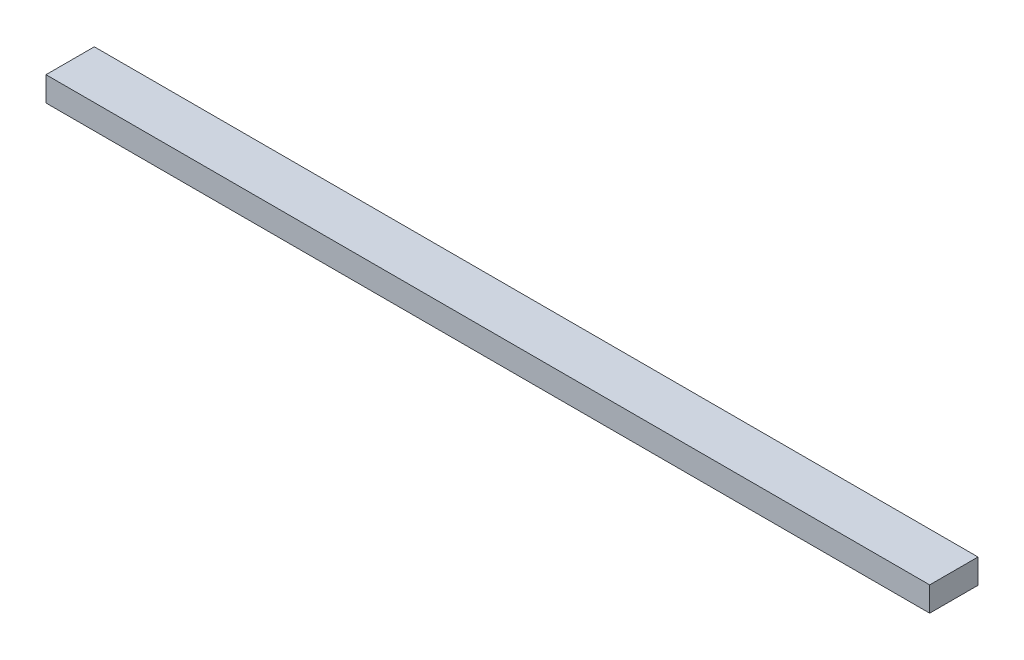
from build123d import *

# Parameters (mm, degrees)
SKETCH1_W               = 18.288
SKETCH1_H               = 0.508
COMPONENT_OUTLINE_DEPTH = 1


with BuildPart() as part:
    # Sketch1 → Component_Outline (new body)
    with BuildSketch(Plane.XY):
        with Locations((8.89, 0)):
            Rectangle(SKETCH1_W, SKETCH1_H)
    extrude(amount=COMPONENT_OUTLINE_DEPTH)


solid = part.part
